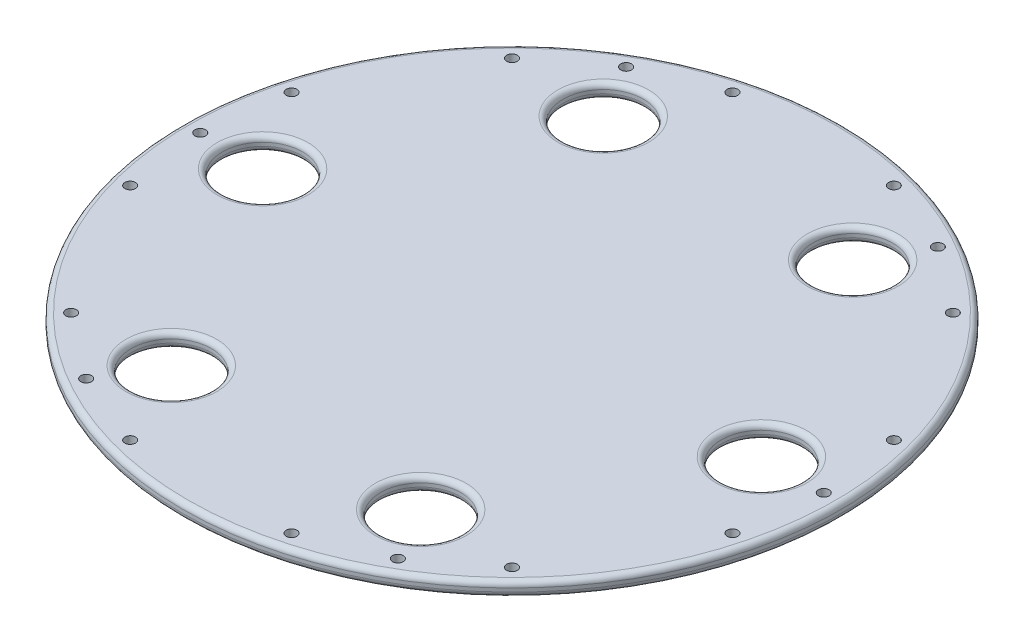
from build123d import *

# Parameters (mm, degrees)
SKETCH1_R           = 92.5
BOSS_EXTRUDE1_DEPTH = 4
SKETCH2_R           = 11.25
SKETCH2_R_2         = 1.5
CUT_EXTRUDE1_DEPTH  = 131.875895412
FILLET1_R           = 1.5


with BuildPart() as part:
    # Sketch1 → Boss-Extrude1 (new body)
    with BuildSketch(Plane(origin=(0, 0, 0), x_dir=(1, 0, 0), z_dir=(0, 1, 0))):
        with Locations(Location((0, 0, 0), (0, 0, 270))):
            Circle(SKETCH1_R)
    extrude(amount=BOSS_EXTRUDE1_DEPTH)

    # Sketch2 → Cut-Extrude1 (cut, through all)
    with BuildSketch(Plane(origin=(0, 4, 0), x_dir=(1, 0, 0), z_dir=(0, 1, 0))):
        with Locations(Location((-35, 60.621778265, 0), (0, 0, 270))):
            Circle(SKETCH2_R)
        with Locations(Location((-43.75, 75.777222831, 0), (0, 0, 270))):
            Circle(SKETCH2_R_2)
        with Locations(Location((-22.646666446, 84.5185098, 0), (0, 0, 270))):
            Circle(SKETCH2_R_2)
        with Locations(Location((-61.871843354, 61.871843354, 0), (0, 0, 270))):
            Circle(SKETCH2_R_2)
        with Locations(Location((43.75, 75.777222831, 0), (0, 0, 270))):
            Circle(SKETCH2_R_2)
        with Locations(Location((22.646666446, 84.5185098, 0), (0, 0, 270))):
            Circle(SKETCH2_R_2)
        with Locations(Location((61.871843354, 61.871843354, 0), (0, 0, 270))):
            Circle(SKETCH2_R_2)
        with Locations(Location((87.5, 0, 0), (0, 0, 270))):
            Circle(SKETCH2_R_2)
        with Locations(Location((84.5185098, 22.646666446, 0), (0, 0, 270))):
            Circle(SKETCH2_R_2)
        with Locations(Location((84.5185098, -22.646666446, 0), (0, 0, 270))):
            Circle(SKETCH2_R_2)
        with Locations(Location((35, 60.621778265, 0), (0, 0, 270))):
            Circle(SKETCH2_R)
        with Locations(Location((70, 0, 0), (0, 0, 270))):
            Circle(SKETCH2_R)
        with Locations(Location((43.75, -75.777222831, 0), (0, 0, 270))):
            Circle(SKETCH2_R_2)
        with Locations(Location((61.871843354, -61.871843354, 0), (0, 0, 270))):
            Circle(SKETCH2_R_2)
        with Locations(Location((22.646666446, -84.5185098, 0), (0, 0, 270))):
            Circle(SKETCH2_R_2)
        with Locations(Location((-43.75, -75.777222831, 0), (0, 0, 270))):
            Circle(SKETCH2_R_2)
        with Locations(Location((-22.646666446, -84.5185098, 0), (0, 0, 270))):
            Circle(SKETCH2_R_2)
        with Locations(Location((-61.871843354, -61.871843354, 0), (0, 0, 270))):
            Circle(SKETCH2_R_2)
        with Locations(Location((-87.5, 0, 0), (0, 0, 270))):
            Circle(SKETCH2_R_2)
        with Locations(Location((-84.5185098, -22.646666446, 0), (0, 0, 270))):
            Circle(SKETCH2_R_2)
        with Locations(Location((-84.5185098, 22.646666446, 0), (0, 0, 270))):
            Circle(SKETCH2_R_2)
        with Locations(Location((35, -60.621778265, 0), (0, 0, 270))):
            Circle(SKETCH2_R)
        with Locations(Location((-35, -60.621778265, 0), (0, 0, 270))):
            Circle(SKETCH2_R)
        with Locations(Location((-70, 0, 0), (0, 0, 270))):
            Circle(SKETCH2_R)
    extrude(amount=-CUT_EXTRUDE1_DEPTH, mode=Mode.SUBTRACT)

    # Fillet1
    fillet1_edges = [part.edges().sort_by_distance(p)[0] for p in [
        (0, 0, -92.5),
        (0, 4, -92.5),
        (70, 0, -11.25),
        (70, 4, -11.25),
        (-35, 0, -71.871778265),
        (-35, 4, -71.871778265),
        (35, 0, -71.871778265),
        (35, 4, -71.871778265),
        (35, 0, 49.371778265),
        (35, 4, 49.371778265),
        (-35, 0, 49.371778265),
        (-35, 4, 49.371778265),
        (-70, 0, -11.25),
        (-70, 4, -11.25),
    ]]
    fillet(fillet1_edges, radius=FILLET1_R)


solid = part.part
